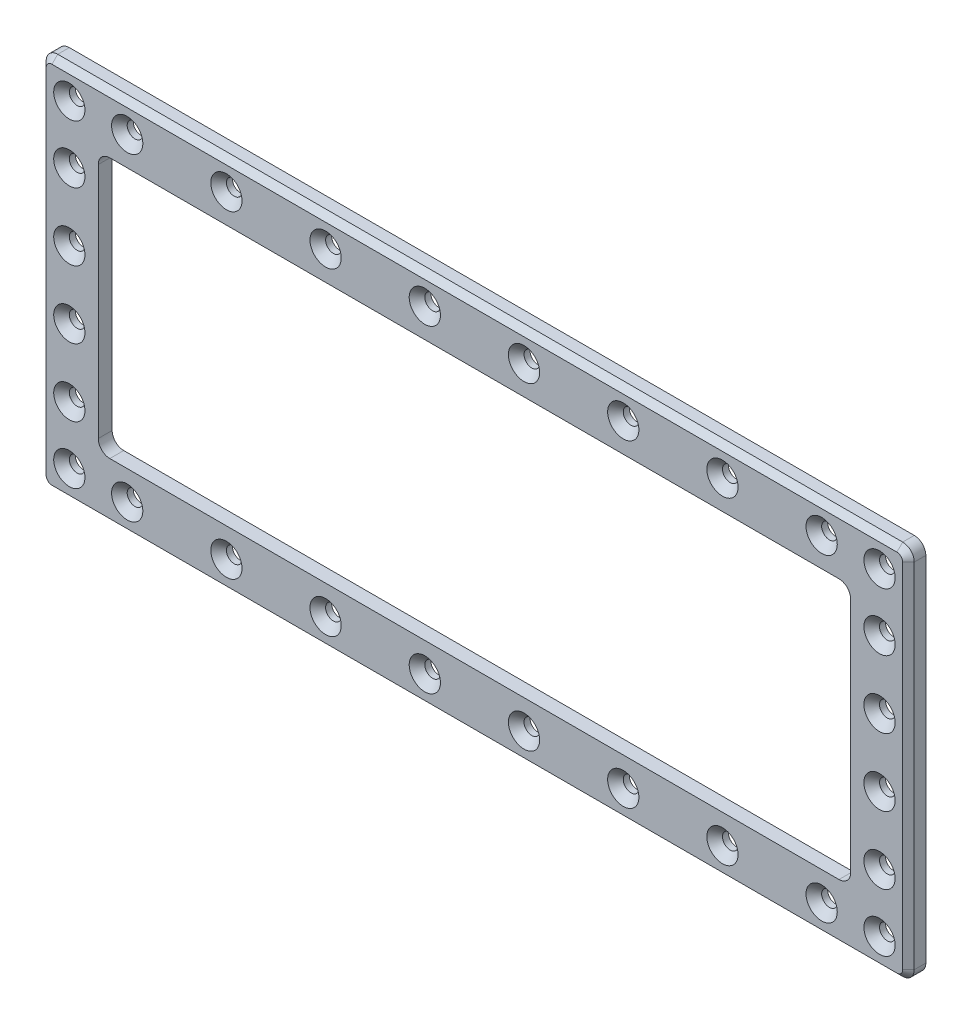
from build123d import *

# Parameters (mm, degrees)
SKETCH1_W                                            = 150
SKETCH1_H                                            = 65
BOSS_EXTRUDE1_DEPTH                                  = 3
SKETCH2_W                                            = 130
SKETCH2_H                                            = 45
CUT_EXTRUDE1_DEPTH                                   = 82.793948431
FILLET1_R                                            = 2
SKETCH3_W                                            = 145
SKETCH3_H                                            = 60
CUT_EXTRUDE2_DEPTH                                   = 0.6
FILLET2_R                                            = 2
CSK_FOR_M2_5_CROSS_RECESSED_CTSK_HEAD_WO_D           = 2.7
CSK_FOR_M2_5_CROSS_RECESSED_CTSK_HEAD_WO_CSINK_D     = 5.4
CSK_FOR_M2_5_CROSS_RECESSED_CTSK_HEAD_WO_CSINK_ANGLE = 90
CHAMFER1_SIZE                                        = 1


with BuildPart() as part:
    # Sketch1 → Boss-Extrude1 (new body)
    with BuildSketch(Plane.XY):
        Rectangle(SKETCH1_W, SKETCH1_H)
    extrude(amount=BOSS_EXTRUDE1_DEPTH)

    # Sketch2 → Cut-Extrude1 (cut, through all)
    with BuildSketch(Plane.XY.offset(3)):
        Rectangle(SKETCH2_W, SKETCH2_H)
    extrude(amount=-CUT_EXTRUDE1_DEPTH, mode=Mode.SUBTRACT)

    # Fillet1
    fillet1_edges = [part.edges().sort_by_distance(p)[0] for p in [
        (-65, -22.5, 1.5),
        (-65, 22.5, 1.5),
        (65, 22.5, 1.5),
        (65, -22.5, 1.5),
        (-75, 32.5, 1.5),
        (75, 32.5, 1.5),
        (75, -32.5, 1.5),
        (-75, -32.5, 1.5),
    ]]
    fillet(fillet1_edges, radius=FILLET1_R)

    # Sketch3 → Cut-Extrude2 (cut)
    with BuildSketch(Plane.XY):
        Rectangle(SKETCH3_W, SKETCH3_H)
    extrude(amount=CUT_EXTRUDE2_DEPTH, mode=Mode.SUBTRACT)

    # Fillet2
    fillet2_edges = [part.edges().sort_by_distance(p)[0] for p in [
        (-72.5, 30, 0.3),
        (-72.5, -30, 0.3),
        (72.5, -30, 0.3),
        (72.5, 30, 0.3),
    ]]
    fillet(fillet2_edges, radius=FILLET2_R)

    # CSK for M2.5 Cross recessed CTSK head wood screws1 (through all)
    with Locations(Plane.XY.offset(3)):
        with Locations((-70, 27.5), (-70, 17.5), (-70, 5.833333333), (-70, -5.833333333), (-70, -17.5), (-70, -27.5), (-60, 27.5), (-42.857142857, 27.5), (-25.714285714, 27.5), (-8.571428571, 27.5), (8.571428571, 27.5), (25.714285714, 27.5), (42.857142857, 27.5), (60, 27.5), (70, 27.5), (70, 17.5), (70, 5.833333333), (70, -5.833333333), (70, -17.5), (70, -27.5), (60, -27.5), (42.857142857, -27.5), (25.714285714, -27.5), (8.571428571, -27.5), (-8.571428571, -27.5), (-25.714285714, -27.5), (-42.857142857, -27.5), (-60, -27.5)):
            CounterSinkHole(CSK_FOR_M2_5_CROSS_RECESSED_CTSK_HEAD_WO_D / 2, CSK_FOR_M2_5_CROSS_RECESSED_CTSK_HEAD_WO_CSINK_D / 2, counter_sink_angle=CSK_FOR_M2_5_CROSS_RECESSED_CTSK_HEAD_WO_CSINK_ANGLE)

    # Chamfer1
    chamfer1_edges = [part.edges().sort_by_distance(p)[0] for p in [
        (0, 32.5, 3),
        (75, 0, 3),
        (-75, 0, 3),
        (0, -32.5, 3),
        (-74.414213562, 31.914213562, 3),
        (-74.414213562, -31.914213562, 3),
        (74.414213562, -31.914213562, 3),
        (74.414213562, 31.914213562, 3),
    ]]
    chamfer(chamfer1_edges, length=CHAMFER1_SIZE)


solid = part.part
